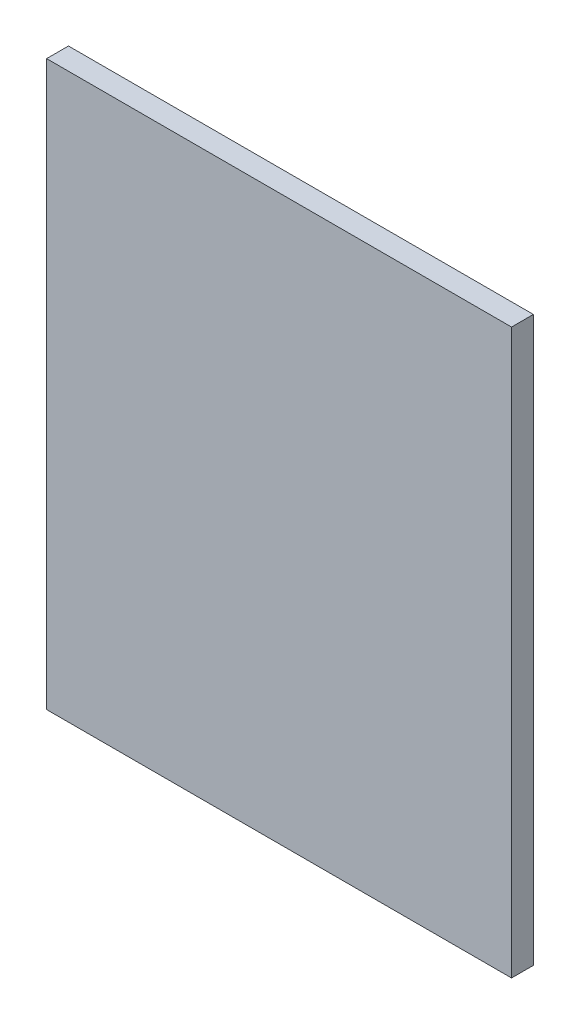
from build123d import *

# Parameters (mm, degrees)
STORE_PU_ARKA_1_START = -758.5
SKETCH1_W             = 1277
SKETCH1_H             = 1548.5
STORE_PU_ARKA_1_DEPTH = 60


with BuildPart() as part:
    # Sketch1 → STORE_pu_arka_1 (new body)
    with BuildSketch(Plane.XY.offset(STORE_PU_ARKA_1_START)):
        with Locations((700, 895.75)):
            Rectangle(SKETCH1_W, SKETCH1_H)
    extrude(amount=-STORE_PU_ARKA_1_DEPTH)


solid = part.part
